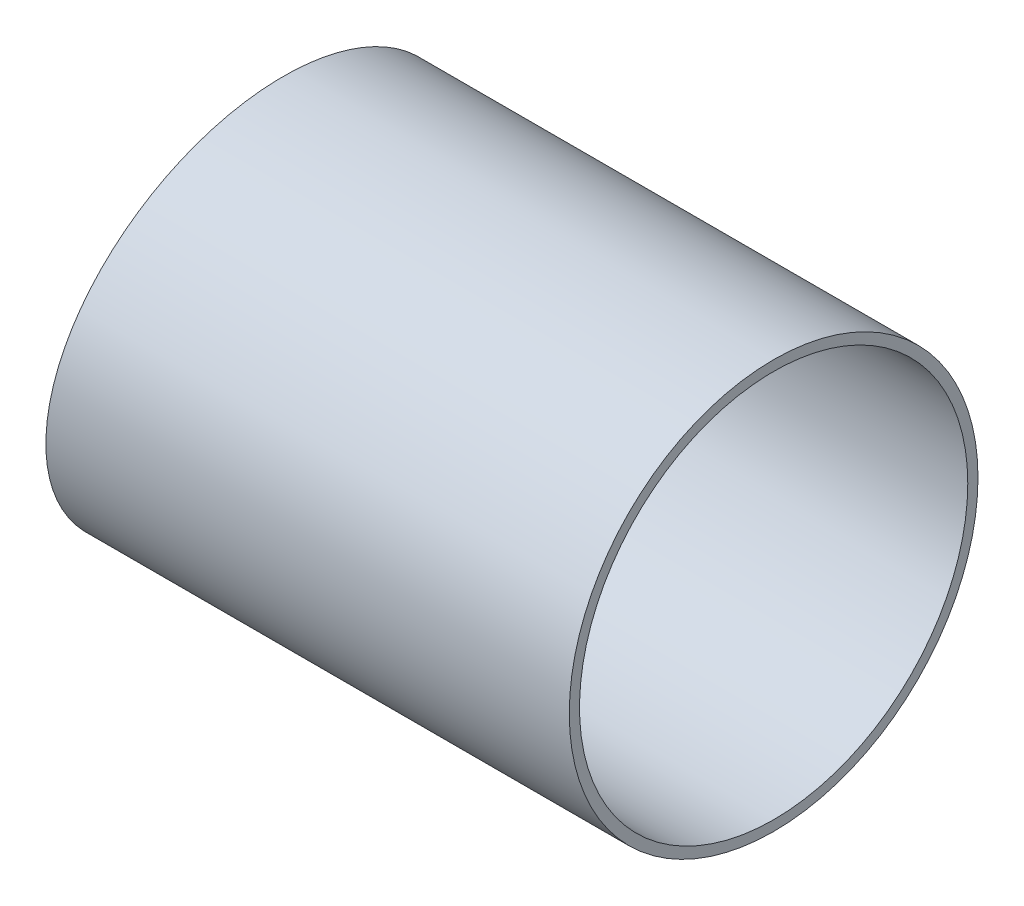
from build123d import *

# Parameters (mm, degrees)
CROQUIS1_R                 = 50
CROQUIS1_R_2               = 47.5
EXTRUIR_L_MINA1_DEPTH      = 135
CORTAR_EXTRUIR1_DEPTH      = 153.397506541
CORTAR_EXTRUIR1_DEPTH_BACK = 153.397506541


with BuildPart() as part:
    # Croquis1 → Extruir-Lámina1 (new body)
    with BuildSketch(Plane(origin=(0, 0, 0), x_dir=(0, 0, -1), z_dir=(1, 0, 0))):
        Circle(CROQUIS1_R)
        Circle(CROQUIS1_R_2, mode=Mode.SUBTRACT)
    extrude(amount=EXTRUIR_L_MINA1_DEPTH)

    # Croquis6 → Cortar-Extruir1 (cut, two sides: drawn at the far end of the back side and taken through both)
    with BuildSketch(Plane.XY.offset(-CORTAR_EXTRUIR1_DEPTH_BACK)):
        Polygon((0, -50), (0, 50), (15, 50), align=None)
    extrude(amount=CORTAR_EXTRUIR1_DEPTH + CORTAR_EXTRUIR1_DEPTH_BACK, mode=Mode.SUBTRACT)


solid = part.part
